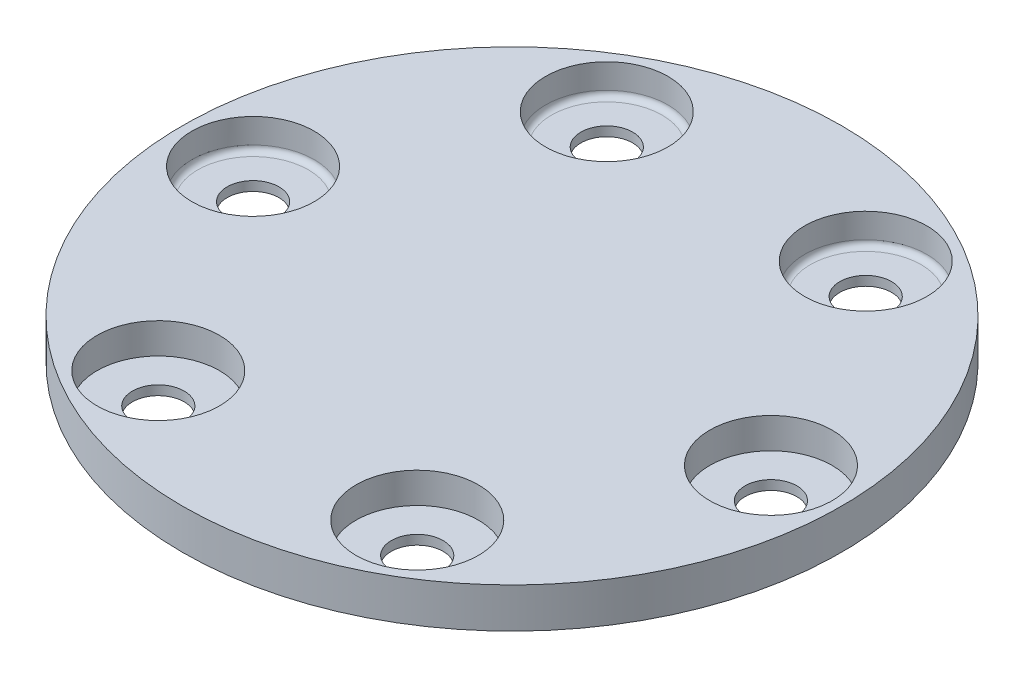
from build123d import *

# Parameters (mm, degrees)
SKETCH1_R           = 14
BOSS_EXTRUDE1_DEPTH = 1.7
CIRPATTERN1_COUNT   = 6
FILLET1_R           = 0.25


with BuildPart() as part:
    # Sketch1 → Boss-Extrude1 (new body)
    with BuildSketch(Plane(origin=(0, 0, 0), x_dir=(1, 0, 0), z_dir=(0, 1, 0))):
        with Locations(Location((0, 0, 0), (0, 0, 270))):
            Circle(SKETCH1_R)
    extrude(amount=BOSS_EXTRUDE1_DEPTH)

    # Sketch14 → CBORE for M5 Hex Head Bolt1 (revolve, cut)
    with BuildSketch(Plane(origin=(-11, 1.7, 0), x_dir=(0, 0, 1), z_dir=(1, 0, 0))):
        Polygon((0, 0), (0, 5.660946681), (1.1, 5), (1.1, 1.3), (2.6, 1.3), (2.6, 0), align=None)
    cbore_for_m5_hex_head_bolt1 = revolve(axis=Axis((-11, 8.05, 0), (0, -1, 0)), mode=Mode.SUBTRACT)

    # CirPattern1: CBORE for M5 Hex Head Bolt1 ×6 about axis
    cirpattern1_axis = Axis((0, 0, 0), (0, 1, 0))
    for i in range(1, CIRPATTERN1_COUNT):
        add(cbore_for_m5_hex_head_bolt1.rotate(cirpattern1_axis, i * 360 / CIRPATTERN1_COUNT), mode=Mode.SUBTRACT)

    # Fillet1
    fillet1_edges = [part.edges().sort_by_distance(p)[0] for p in [
        (-3.24833395, 0.4, -10.826279442),
        (7.75166605, 0.4, -8.226279442),
        (-11, 0.4, -2.6),
    ]]
    fillet(fillet1_edges, radius=FILLET1_R)


solid = part.part
